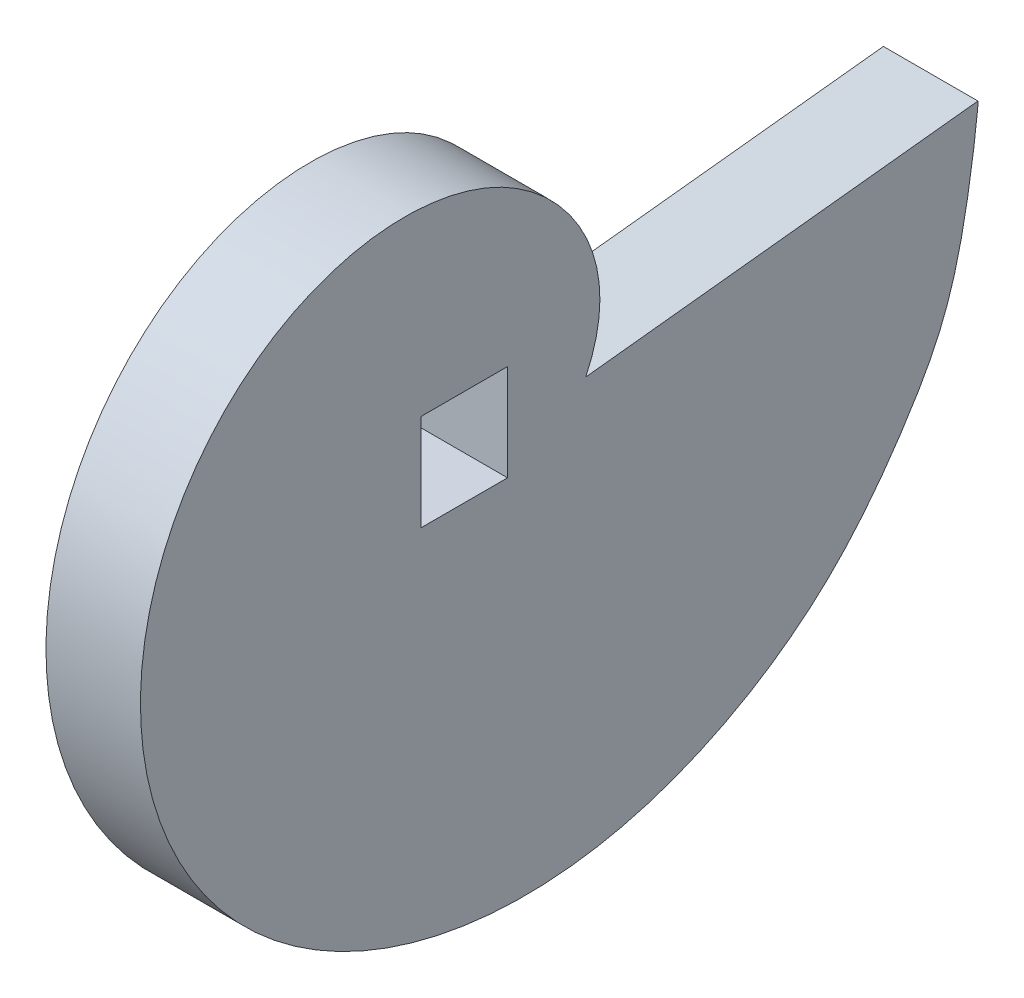
from build123d import *

# Parameters (mm, degrees)
SKETCH1_W           = 6.416745928
SKETCH1_H           = 7.140404168
BOSS_EXTRUDE1_DEPTH = 7


with BuildPart() as part:
    # Sketch1 → Boss-Extrude1 (new body)
    with BuildSketch(Plane(origin=(0, 0, 0), x_dir=(0, 0, -1), z_dir=(1, 0, 0))):
        with BuildLine():
            Line((38.044741382, 3.183478212), (9, 0))
            add(Edge.make_bspline(
                [(9, 0), (12.019660327, 6.259467509), (6.142659861, 15.799084467), (-6.33620297, 17.673586478), (-15.08422068, 14.353217156), (-21.390639232, 7.525773733), (-24.362259203, -1.227378311), (-23.817499081, -10.422052284), (-20.074607615, -18.809548362), (-13.767802552, -25.45872523), (-5.698257282, -29.769099046), (3.281696943, -31.443568181), (12.351906091, -30.469354485), (20.788364062, -26.981619941), (27.979268509, -21.527728568), (33.520562761, -13.828372807), (36.935318584, -7.160318356), (38.135363247, 3.091438957), (38.050772101, 3.184139215)],
                knots=[0, 0, 0, 0, 0.114285714, 0.171428571, 0.228571429, 0.285714286, 0.342857143, 0.4, 0.457142857, 0.514285714, 0.571428571, 0.628571429, 0.685714286, 0.742857143, 0.8, 0.857142857, 0.914285714, 0.971428571, 0.971428571, 0.971428571, 0.971428571], degree=3))
            Line((38.050772101, 3.184139215), (38.044741382, 3.183478212))
        make_face()
        Rectangle(SKETCH1_W, SKETCH1_H, mode=Mode.SUBTRACT)
    extrude(amount=BOSS_EXTRUDE1_DEPTH)


solid = part.part
